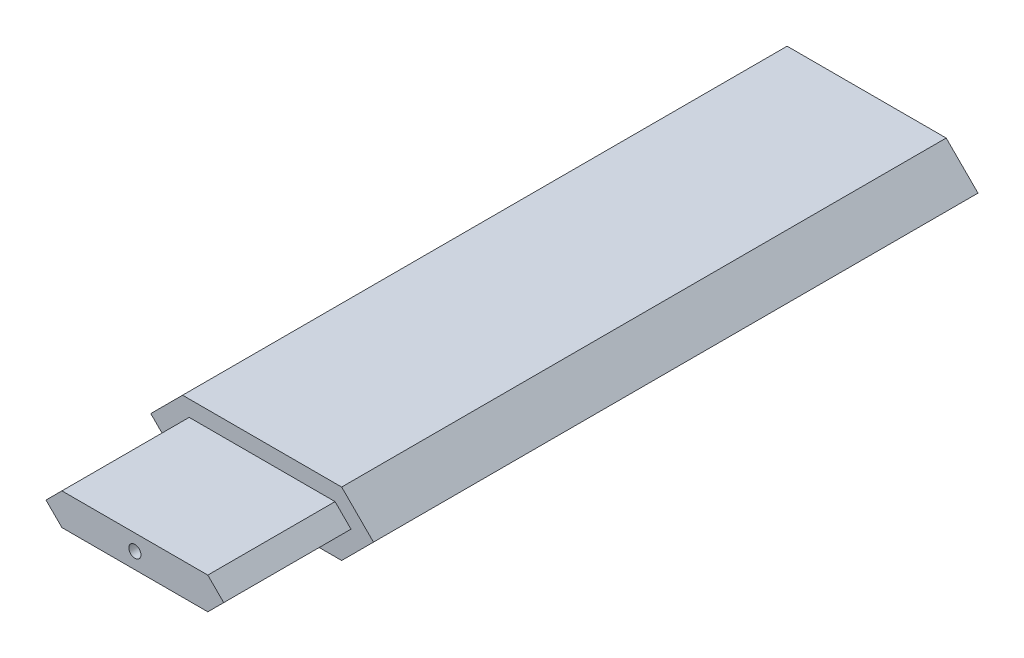
from build123d import *

# Parameters (mm, degrees)
EXTRUDE_1_DEPTH          = 18
CHAMFER_1_SIZE           = 5
CHAMFER_2_SIZE           = 5
CUT_EXTRUDE_1_DEPTH      = 8
EXTRUDE_2_REACH          = 696.741
EXTRUDE_2_END_RADIUS     = 240
EXTRUDE_3_DEPTH          = 5
EXTRUDE_4_REACH          = 929.644
EXTRUDE_4_END_RADIUS     = 232
SKETCH_10_R              = 12
CUT_EXTRUDE_7_DEPTH      = 695.872110635
CUT_EXTRUDE_7_DEPTH_BACK = 695.872110635
SKETCH_16_OUTSIDE_W      = 362.68
SKETCH_16_OUTSIDE_H      = 1204.68
SKETCH_16_OUTSIDE_W_2    = 100
SKETCH_16_OUTSIDE_H_2    = 230
SKETCH_21_R              = 1.9
CUT_EXTRUDE_17_DEPTH     = 233.862620444
SKETCH_34_OUTSIDE_W      = 120.25
SKETCH_34_OUTSIDE_H      = 70.25
CUT_EXTRUDE_18_DEPTH     = 40
CUT_EXTRUDE_19_DEPTH     = 41


with BuildPart() as part:
    # 草图4 → 放样1 section 0
    with BuildSketch(Plane(origin=(0, 10, 0), x_dir=(1, 0, 0), z_dir=(0, 1, 0))):
        with BuildLine():
            Line((25, 0), (-25, 0))
            Line((-25, 0), (-25, 630))
            Line((-25, 630), (0, 672.857142857))
            Line((0, 672.857142857), (25, 630))
            Line((25, 630), (25, 0))
        make_face()
    # 草图1 → 放样1 section 1
    with BuildSketch(Plane(origin=(0, 0, 0), x_dir=(1, 0, 0), z_dir=(0, 1, 0))):
        with BuildLine():
            Line((-35, 0), (35, 0))
            Line((35, 0), (35, 630))
            Line((35, 630), (0, 690))
            Line((0, 690), (-35, 630))
            Line((-35, 630), (-35, 0))
        make_face()
    loft_1 = loft()

    # 镜向1: 放样1 across plane
    add(loft_1.mirror(Plane.ZX))



with BuildPart() as body_2:
    # 草图5 → 凸台-拉伸1 (new, symmetric)
    with BuildSketch(Plane(origin=(0, 0, 0), x_dir=(1, 0, 0), z_dir=(0, 1, 0))):
        with BuildLine():
            ThreePointArc((-66.346774613, -65.189169183), (0, -55.5), (66.346774613, -65.189169183))
            ThreePointArc((66.346774613, -65.189169183), (73.061224406, -64.270510235), (76.791165228, -58.612302768))
            ThreePointArc((76.791165228, -58.612302768), (79, -30.5), (76.791165228, -2.387697232))
            ThreePointArc((76.791165228, -2.387697232), (0, -15.004503167), (-76.791165228, -2.387697232))
            ThreePointArc((-76.791165228, -2.387697232), (-79, -30.5), (-76.791165228, -58.612302768))
            ThreePointArc((-76.791165228, -58.612302768), (-73.061224406, -64.270510235), (-66.346774613, -65.189169183))
        make_face()
    extrude(amount=EXTRUDE_1_DEPTH, both=True)

    # 倒角1
    chamfer_1_edges = [body_2.edges().sort_by_distance(p)[0] for p in [
        (0, 18, 15.004503167),
        (-79, 18, 30.5),
        (-73.061224406, 18, 64.270510235),
        (0, 18, 55.5),
        (73.061224406, 18, 64.270510235),
        (0, -18, 55.5),
        (-73.061224406, -18, 64.270510235),
        (-79, -18, 30.5),
        (79, -18, 30.5),
        (73.061224406, -18, 64.270510235),
        (79, 18, 30.5),
    ]]
    chamfer(chamfer_1_edges, length=CHAMFER_1_SIZE)

    # 倒角2
    chamfer_2_edges = [body_2.edges().sort_by_distance(p)[0] for p in [
        (0, -18, 15.004503167),
    ]]
    chamfer(chamfer_2_edges, length=CHAMFER_2_SIZE)

    # 草图6 → 切除-拉伸1 (cut)
    with BuildSketch(Plane(origin=(0, 18, 0), x_dir=(1, 0, 0), z_dir=(0, 1, 0))):
        with BuildLine():
            ThreePointArc((67.221840199, -55.023712607), (68.932610365, -35.286223394), (68.335500378, -15.483731767))
            ThreePointArc((68.335500378, -15.483731767), (0, -25.004503167), (-68.335500378, -15.483731767))
            ThreePointArc((-68.335500378, -15.483731767), (-68.932610365, -35.286223394), (-67.221840199, -55.023712607))
            ThreePointArc((-67.221840199, -55.023712607), (0, -45.5), (67.221840199, -55.023712607))
        make_face()
    cut_extrude_1 = extrude(amount=-CUT_EXTRUDE_1_DEPTH, mode=Mode.SUBTRACT)

    # 镜向2: 切除-拉伸1 across plane
    add(cut_extrude_1.mirror(Plane.ZX), mode=Mode.SUBTRACT)


with BuildPart() as part_1:
    add(part.part)

    add(body_2.part)  # 凸台-拉伸2 merges body 2
    # 凸台-拉伸2: up to this cylinder (the profile starts inside it)
    extrude_2_end = Plane(origin=(0, 0, -224.995496833), z_dir=(0, -1, 0)) * Cylinder(EXTRUDE_2_END_RADIUS, 1874.482, mode=Mode.PRIVATE)
    # 草图7 → 凸台-拉伸2 (add, up to the surface)
    with BuildSketch(Plane.XY, mode=Mode.PRIVATE) as extrude_2_sk1:
        Polygon((-25.828427125, 12), (-37.828427125, 0), (-25.828427125, -12), (25.828427125, -12), (37.828427125, 0), (25.828427125, 12), align=None)
    extrude_2_tool1 = extrude(extrude_2_sk1.sketch, amount=EXTRUDE_2_REACH, mode=Mode.PRIVATE) & extrude_2_end
    add(extrude_2_tool1.solids().sort_by_distance((0, 0, 0))[0])

    # 草图8 → 凸台-拉伸3 (add)
    with BuildSketch(Plane(origin=(0, 0, 0), x_dir=(-1, 0, 0), z_dir=(0, 0, -1))):
        Polygon((25.828427125, 12), (-25.828427125, 12), (-37.828427125, 0), (-25.828427125, -12), (25.828427125, -12), (37.828427125, 0), align=None)
    extrude(amount=EXTRUDE_3_DEPTH)



with BuildPart() as body_2_2:
    # 草图9 → 旋转1 (revolve)
    with BuildSketch(Plane(origin=(0, 0, 0), x_dir=(1, 0, 0), z_dir=(0, 1, 0))):
        Polygon((0, -310), (0, -234), (-12, -234), (-22.5, -256), align=None)
    revolve(axis=Axis((0, 0, -690), (0, 0, 1)))


with BuildPart() as part_2:
    add(part_1.part)

    add(body_2_2.part)  # 凸台-拉伸4 merges body 2 2
    # 凸台-拉伸4: up to this cylinder (the profile starts inside it)
    extrude_4_end = Plane(origin=(0, 0, 287.5), z_dir=(0, -1, 0)) * Cylinder(EXTRUDE_4_END_RADIUS, 2324.288, mode=Mode.PRIVATE)
    # 草图10 → 凸台-拉伸4 (add, up to the surface)
    with BuildSketch(Plane(origin=(0, 0, 234), x_dir=(-1, 0, 0), z_dir=(0, 0, -1)), mode=Mode.PRIVATE) as extrude_4_sk1:
        with Locations(Location((0, 0, 0), (0, 0, 90))):
            Circle(SKETCH_10_R)
    extrude_4_tool1 = extrude(extrude_4_sk1.sketch, amount=EXTRUDE_4_REACH, mode=Mode.PRIVATE) & extrude_4_end
    add(extrude_4_tool1.solids().sort_by_distance((0, 0, 234))[0])

    # 草图16 outside → 切除-拉伸7 (cut, two sides: drawn at the far end of the back side and taken through both)
    with BuildSketch(Plane(origin=(0, 0, 0), x_dir=(1, 0, 0), z_dir=(0, 1, 0)).offset(-CUT_EXTRUDE_7_DEPTH_BACK)):
        with Locations((0, 190)):
            Rectangle(SKETCH_16_OUTSIDE_W, SKETCH_16_OUTSIDE_H)
        with Locations((0, 270)):
            Rectangle(SKETCH_16_OUTSIDE_W_2, SKETCH_16_OUTSIDE_H_2, mode=Mode.SUBTRACT)
    extrude(amount=CUT_EXTRUDE_7_DEPTH + CUT_EXTRUDE_7_DEPTH_BACK, mode=Mode.SUBTRACT)

    # 草图21 → 切除-拉伸17 (cut, through all)
    with BuildSketch(Plane.XY.offset(-155)):
        Circle(SKETCH_21_R)
    extrude(amount=-CUT_EXTRUDE_17_DEPTH, mode=Mode.SUBTRACT)

    # 草图34 outside → 切除-拉伸18 (cut)
    with BuildSketch(Plane.XY.offset(-155)):
        Rectangle(SKETCH_34_OUTSIDE_W, SKETCH_34_OUTSIDE_H)
        Polygon((-22.928932188, -5), (22.928932188, -5), (27.928932188, 0), (22.928932188, 5), (-22.928932188, 5), (-27.928932188, 0), align=None, mode=Mode.SUBTRACT)
    extrude(amount=-CUT_EXTRUDE_18_DEPTH, mode=Mode.SUBTRACT)

    # 草图35 → 切除-拉伸19 (cut)
    with BuildSketch(Plane(origin=(0, 0, -385), x_dir=(-1, 0, 0), z_dir=(0, 0, -1))):
        Polygon((-28.211774901, 0), (-23.011774901, -5.2), (23.011774901, -5.2), (28.211774901, 0), (23.011774901, 5.2), (-23.011774901, 5.2), align=None)
    extrude(amount=-CUT_EXTRUDE_19_DEPTH, mode=Mode.SUBTRACT)


solid = part_2.part
